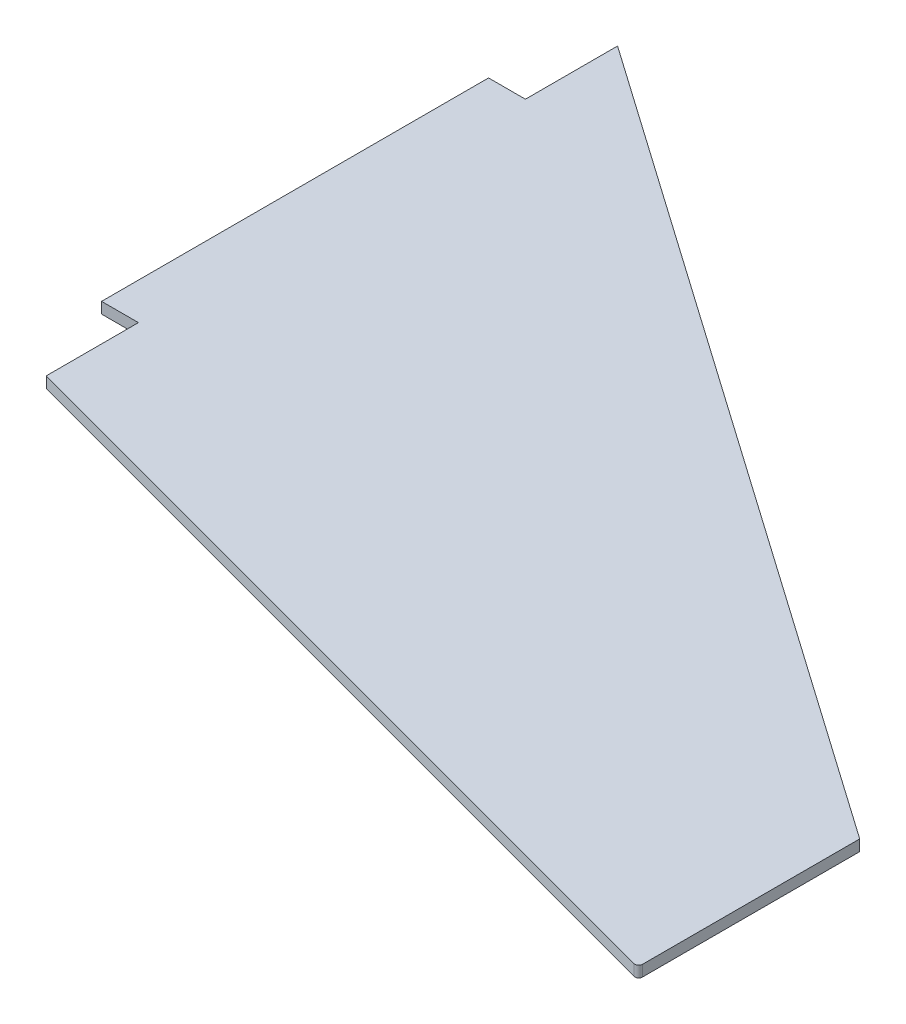
from build123d import *

# Parameters (mm, degrees)
BOSS_EXTRUDE1_DEPTH = 3


with BuildPart() as part:
    # Sketch1 → Boss-Extrude1 (new body)
    with BuildSketch(Plane(origin=(0, 0, 0), x_dir=(1, 0, 0), z_dir=(0, 1, 0))):
        with BuildLine():
            Line((0, -130), (0, -105))
            Line((0, -105), (-10, -105))
            Line((-10, -105), (-10, 0))
            Line((-10, 0), (0, 0))
            Line((0, 0), (0, 25))
            Line((0, 25), (219.162, -128.458884489))
            Line((219.162, -128.458884489), (219.162, -187.421055539))
            ThreePointArc((219.162, -187.421055539), (218.770761429, -188.214408879), (217.903180955, -188.386981365))
            Line((217.903180955, -188.386981365), (0, -130))
        make_face()
    extrude(amount=BOSS_EXTRUDE1_DEPTH)


solid = part.part
